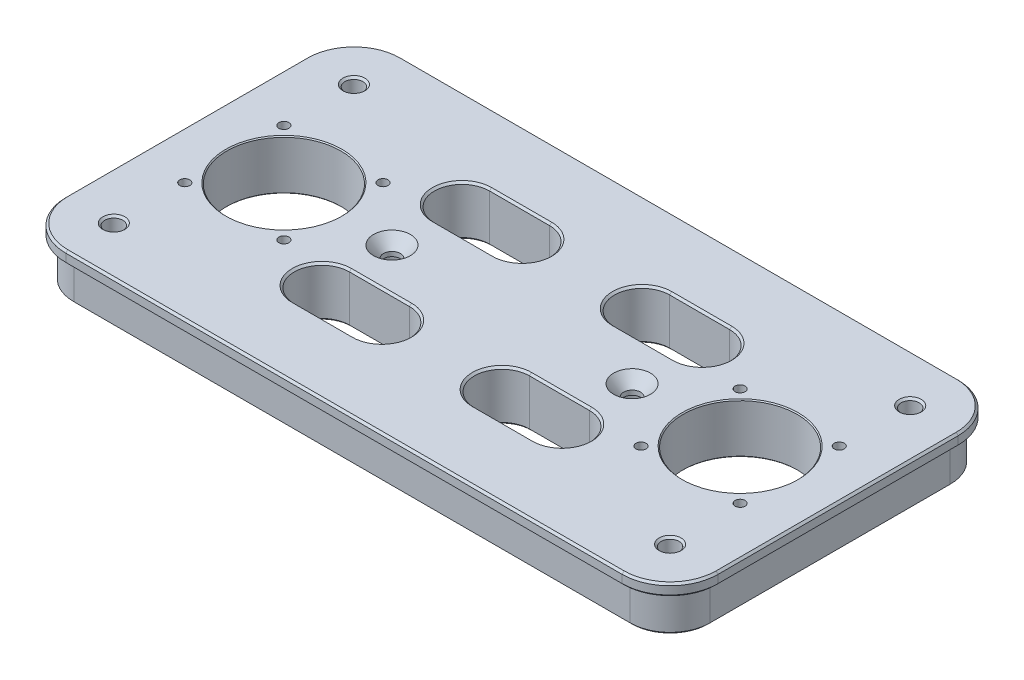
from build123d import *

# Parameters (mm, degrees)
SKETCH1_W                                            = 318
SKETCH1_H                                            = 160
BOSS_EXTRUDE1_DEPTH                                  = 25
SKETCH2_R                                            = 28.5
CUT_EXTRUDE1_DEPTH                                   = 180.738699228
CUT_EXTRUDE2_DEPTH                                   = 180.738699228
CUT_EXTRUDE2_DEPTH_BACK                              = 180.738699228
SKETCH4_R                                            = 9.55
CHAMFER1_SIZE                                        = 0.5
FILLET1_R                                            = 20
M8_CLEARANCE_HOLE1_D                                 = 9
M6X1_0_TAPPED_HOLE1_D                                = 5
SKETCH13_R                                           = 13.411040831
SKETCH13_R_2                                         = 14.724493856
BOSS_EXTRUDE3_DEPTH                                  = 8
CSK_FOR_5_16_FLAT_HEAD_SOCKET_CAP_SCREW1_D           = 8.4328
CSK_FOR_5_16_FLAT_HEAD_SOCKET_CAP_SCREW1_CSINK_D     = 18.4009792
CSK_FOR_5_16_FLAT_HEAD_SOCKET_CAP_SCREW1_CSINK_ANGLE = 82
BOSS_EXTRUDE4_DEPTH                                  = 6
CUT_EXTRUDE3_DEPTH                                   = 186.067555233
M6X1_0_TAPPED_HOLE2_D                                = 5
M6X1_0_TAPPED_HOLE2_DEPTH                            = 15
M6X1_0_TAPPED_HOLE2_TIP                              = 1.502151548
MIRROR2_COPY_1_DEPTH                                 = 186.067555233
CHAMFER4_SIZE                                        = 1


with BuildPart() as part:
    # Sketch1 → Boss-Extrude1 (new body)
    with BuildSketch(Plane(origin=(0, 0, 0), x_dir=(1, 0, 0), z_dir=(0, 1, 0))):
        Rectangle(SKETCH1_W, SKETCH1_H)
    extrude(amount=BOSS_EXTRUDE1_DEPTH)

    # Sketch2 → Cut-Extrude1 (cut, through all)
    with BuildSketch(Plane(origin=(0, 25, 0), x_dir=(1, 0, 0), z_dir=(0, 1, 0))):
        with Locations(Location((-114, 0, 0), (0, 0, 270))):
            Circle(SKETCH2_R)
        with Locations(Location((114, 0, 0), (0, 0, 270))):
            Circle(SKETCH2_R)
    extrude(amount=-CUT_EXTRUDE1_DEPTH, mode=Mode.SUBTRACT)

    # Sketch4 → Cut-Extrude2 (cut, two sides: drawn at the far end of the back side and taken through both)
    with BuildSketch(Plane(origin=(0, 25, 0), x_dir=(1, 0, 0), z_dir=(0, 1, 0)).offset(-CUT_EXTRUDE2_DEPTH_BACK)):
        with Locations(Location((-60, 0, 0), (0, 0, 270))):
            Circle(SKETCH4_R)
        with Locations(Location((60, 0, 0), (0, 0, 270))):
            Circle(SKETCH4_R)
    extrude(amount=CUT_EXTRUDE2_DEPTH + CUT_EXTRUDE2_DEPTH_BACK, mode=Mode.SUBTRACT)

    # Chamfer1
    chamfer1_edges = [part.edges().sort_by_distance(p)[0] for p in [
        (-114, 0, -28.5),
        (-114, 25, -28.5),
        (114, 0, -28.5),
        (114, 25, -28.5),
        (-60, 0, -9.55),
        (-60, 25, -9.55),
        (60, 0, -9.55),
        (60, 25, -9.55),
    ]]
    chamfer(chamfer1_edges, length=CHAMFER1_SIZE)

    # Fillet1
    fillet1_edges = [part.edges().sort_by_distance(p)[0] for p in [
        (159, 12.5, 80),
        (-159, 12.5, 80),
        (-159, 12.5, -80),
        (159, 12.5, -80),
    ]]
    fillet(fillet1_edges, radius=FILLET1_R)

    # M8 Clearance Hole1 (through all)
    with Locations(Plane.XZ):
        with Locations((-139, -60), (-139, 60), (139, -60), (139, 60)):
            Hole(M8_CLEARANCE_HOLE1_D / 2)

    # M6x1.0 Tapped Hole1 (through all)
    with Locations(Plane(origin=(0, 0, 0), x_dir=(-1, 0, 0), z_dir=(0, -1, 0))):
        with Locations((138.765, -24.765), (89.235, -24.765), (89.235, 24.765), (138.765, 24.765), (-89.235, -24.765), (-138.765, -24.765), (-89.235, 24.765), (-138.765, 24.765)):
            Hole(M6X1_0_TAPPED_HOLE1_D / 2)

    # Sketch13 → Boss-Extrude3 (add)
    with BuildSketch(Plane(origin=(0, 25, 0), x_dir=(1, 0, 0), z_dir=(0, 1, 0))):
        with Locations((60, 0)):
            Circle(SKETCH13_R)
        with Locations((-60, 0)):
            Circle(SKETCH13_R_2)
    extrude(amount=-BOSS_EXTRUDE3_DEPTH)

    # CSK for 5/16 Flat Head Socket Cap Screw1 (through all)
    with Locations(Plane(origin=(0, 25, 0), x_dir=(1, 0, 0), z_dir=(0, 1, 0))):
        with Locations((60, 0), (-60, 0)):
            CounterSinkHole(CSK_FOR_5_16_FLAT_HEAD_SOCKET_CAP_SCREW1_D / 2, CSK_FOR_5_16_FLAT_HEAD_SOCKET_CAP_SCREW1_CSINK_D / 2, counter_sink_angle=CSK_FOR_5_16_FLAT_HEAD_SOCKET_CAP_SCREW1_CSINK_ANGLE)

    # Sketch16 → Boss-Extrude4 (add)
    with BuildSketch(Plane.XZ.offset(-25)):
        with BuildLine():
            Line((163, -60), (163, 60))
            ThreePointArc((163, 60), (155.970562748, 76.970562748), (139, 84))
            Line((139, 84), (-139, 84))
            ThreePointArc((-139, 84), (-155.970562748, 76.970562748), (-163, 60))
            Line((-163, 60), (-163, -60))
            ThreePointArc((-163, -60), (-155.970562748, -76.970562748), (-139, -84))
            Line((-139, -84), (139, -84))
            ThreePointArc((139, -84), (155.970562748, -76.970562748), (163, -60))
        make_face()
        with BuildLine():
            Line((159, 60), (159, -60))
            ThreePointArc((159, -60), (153.142135624, -74.142135624), (139, -80))
            Line((139, -80), (-139, -80))
            ThreePointArc((-139, -80), (-153.142135624, -74.142135624), (-159, -60))
            Line((-159, -60), (-159, 60))
            ThreePointArc((-159, 60), (-153.142135624, 74.142135624), (-139, 80))
            Line((-139, 80), (139, 80))
            ThreePointArc((139, 80), (153.142135624, 74.142135624), (159, 60))
        make_face(mode=Mode.SUBTRACT)
    extrude(amount=BOSS_EXTRUDE4_DEPTH)

    # Sketch17 → Cut-Extrude3 (cut, through all)
    with BuildSketch(Plane.XZ):
        with BuildLine():
            Line((-60, -21.237304048), (-30, -21.237304048))
            ThreePointArc((-30, -21.237304048), (-16.218066161, -35.019237886), (-30, -48.801171725))
            Line((-30, -48.801171725), (-60, -48.801171725))
            ThreePointArc((-60, -48.801171725), (-73.781933839, -35.019237886), (-60, -21.237304048))
        make_face()
    cut_extrude3 = extrude(amount=-CUT_EXTRUDE3_DEPTH, mode=Mode.SUBTRACT)

    # M6x1.0 Tapped Hole2
    with Locations(Plane(origin=(0, 0, 0), x_dir=(-1, 0, 0), z_dir=(0, -1, 0))):
        with Locations((-75, 70), (-45, 70), (-105, 70), (-15, 70), (15, 70), (45, 70), (75, 70), (105, 70), (-105, -70), (-75, -70), (-45, -70), (-15, -70), (15, -70), (45, -70), (75, -70), (105, -70)):
            Hole(M6X1_0_TAPPED_HOLE2_D / 2, depth=M6X1_0_TAPPED_HOLE2_DEPTH)
            with Locations((0, 0, -(M6X1_0_TAPPED_HOLE2_DEPTH + M6X1_0_TAPPED_HOLE2_TIP / 2))):  # 118° drill point
                Cone(0, M6X1_0_TAPPED_HOLE2_D / 2, M6X1_0_TAPPED_HOLE2_TIP, mode=Mode.SUBTRACT)

    # Mirror1: Cut-Extrude3 across plane
    add(cut_extrude3.mirror(Plane(origin=(0, 0, 0), x_dir=(0, 0, 1), z_dir=(1, 0, 0))), mode=Mode.SUBTRACT)

    # Mirror2: Cut-Extrude3 across plane
    add(cut_extrude3.mirror(Plane.XY), mode=Mode.SUBTRACT)

    # Mirror2 copy 1 sketch → Mirror2 copy 1 (cut, through all)
    with BuildSketch(Plane(origin=(0, 0, 0), x_dir=(-1, 0, 0), z_dir=(0, -1, 0))):
        with BuildLine():
            Line((-60, -21.237304048), (-30, -21.237304048))
            ThreePointArc((-30, -21.237304048), (-16.218066161, -35.019237886), (-30, -48.801171725))
            Line((-30, -48.801171725), (-60, -48.801171725))
            ThreePointArc((-60, -48.801171725), (-73.781933839, -35.019237886), (-60, -21.237304048))
        make_face()
    extrude(amount=-MIRROR2_COPY_1_DEPTH, mode=Mode.SUBTRACT)

    # Chamfer4
    chamfer4_edges = [part.edges().sort_by_distance(p)[0] for p in [
        (-134.5, 0, 60),
        (-134.5, 25, 60),
        (-134.5, 0, -60),
        (-134.5, 25, -60),
        (155.970562748, 19, -76.970562748),
        (163, 19, 0),
        (155.970562748, 19, 76.970562748),
        (0, 19, 84),
        (-155.970562748, 19, 76.970562748),
        (-163, 19, 0),
        (-155.970562748, 19, -76.970562748),
        (0, 19, -84),
        (155.970562748, 25, -76.970562748),
        (163, 25, 0),
        (155.970562748, 25, 76.970562748),
        (0, 25, 84),
        (-155.970562748, 25, 76.970562748),
        (-163, 25, 0),
        (-155.970562748, 25, -76.970562748),
        (0, 25, -84),
        (-73.781933839, 25, -35.019237886),
        (-45, 25, -21.237304048),
        (-16.218066161, 25, -35.019237886),
        (-45, 25, -48.801171725),
        (-73.781933839, 0, -35.019237886),
        (-45, 0, -48.801171725),
        (-16.218066161, 0, -35.019237886),
        (-45, 0, -21.237304048),
        (73.781933839, 0, -35.019237886),
        (45, 0, -48.801171725),
        (16.218066161, 0, -35.019237886),
        (45, 0, -21.237304048),
        (73.781933839, 25, -35.019237886),
        (45, 25, -48.801171725),
        (16.218066161, 25, -35.019237886),
        (45, 25, -21.237304048),
        (73.781933839, 25, 35.019237886),
        (45, 25, 21.237304048),
        (16.218066161, 25, 35.019237886),
        (45, 25, 48.801171725),
        (73.781933839, 0, 35.019237886),
        (45, 0, 48.801171725),
        (16.218066161, 0, 35.019237886),
        (45, 0, 21.237304048),
        (-73.781933839, 0, 35.019237886),
        (-45, 0, 48.801171725),
        (-16.218066161, 0, 35.019237886),
        (-45, 0, 21.237304048),
        (-73.781933839, 25, 35.019237886),
        (-45, 25, 48.801171725),
        (-16.218066161, 25, 35.019237886),
        (-45, 25, 21.237304048),
        (159, 0, 0),
        (0, 0, 80),
        (-159, 0, 0),
        (0, 0, -80),
        (-153.142135624, 0, 74.142135624),
        (-153.142135624, 0, -74.142135624),
        (153.142135624, 0, -74.142135624),
        (153.142135624, 0, 74.142135624),
        (143.5, 0, 60),
        (143.5, 25, 60),
        (143.5, 0, -60),
        (143.5, 25, -60),
    ]]
    chamfer(chamfer4_edges, length=CHAMFER4_SIZE)


solid = part.part
